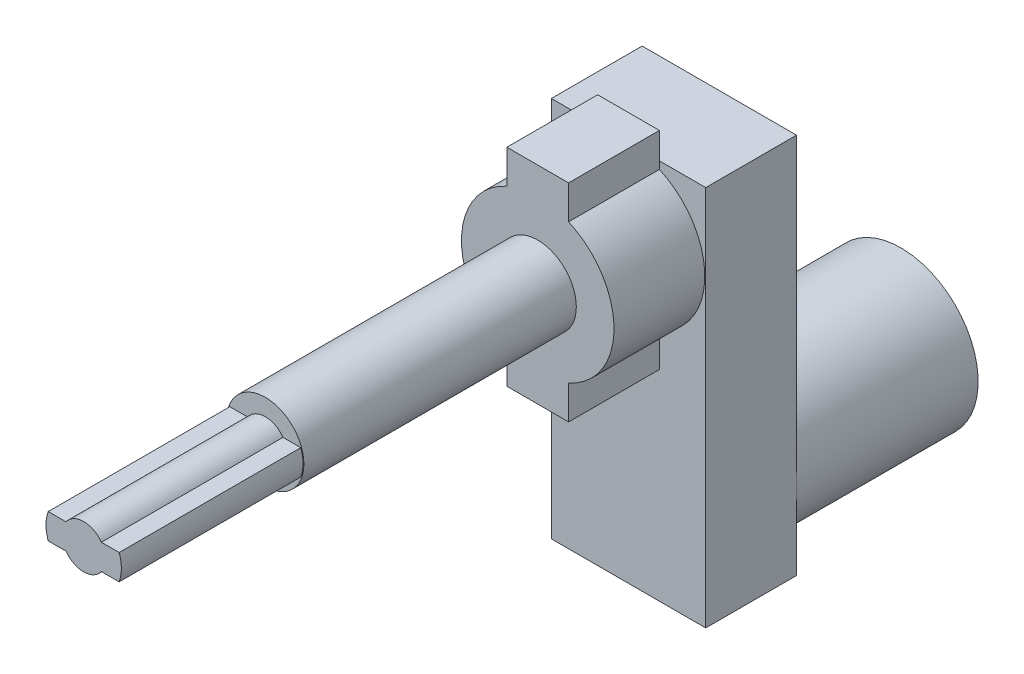
from build123d import *

# Parameters (mm, degrees)
BOSS_EXTRUDE2_START = -20
SKETCH3_R           = 4.25
BOSS_EXTRUDE2_DEPTH = 30
BOSS_EXTRUDE3_START = 10
SKETCH4_R           = 8.5
BOSS_EXTRUDE3_DEPTH = 10
SKETCH5_W           = 17
SKETCH5_H           = 42
BOSS_EXTRUDE4_DEPTH = 10
SKETCH6_R           = 8.5
BOSS_EXTRUDE5_DEPTH = 20
SKETCH9_W           = 7
SKETCH9_H           = 7
CUT_EXTRUDE1_DEPTH  = 20
BOSS_EXTRUDE7_DEPTH = 10
BOSS_EXTRUDE8_DEPTH = 20


with BuildPart() as part:
    # Sketch3 → Boss-Extrude2 (new body)
    with BuildSketch(Plane.XY.offset(16).offset(BOSS_EXTRUDE2_START)):
        Circle(SKETCH3_R)
    extrude(amount=BOSS_EXTRUDE2_DEPTH)



with BuildPart() as body_2:
    # Sketch4 → Boss-Extrude3 (new body)
    with BuildSketch(Plane(origin=(0, 0, -4), x_dir=(-1, 0, 0), z_dir=(0, 0, -1)).offset(BOSS_EXTRUDE3_START)):
        Circle(SKETCH4_R)
    extrude(amount=BOSS_EXTRUDE3_DEPTH)

    # Sketch5 → Boss-Extrude4 (add)
    with BuildSketch(Plane(origin=(0, 0, -24), x_dir=(-1, 0, 0), z_dir=(0, 0, -1))):
        with Locations((0, -12.5)):
            Rectangle(SKETCH5_W, SKETCH5_H)
    extrude(amount=-BOSS_EXTRUDE4_DEPTH)

    # Sketch6 → Boss-Extrude5 (add)
    with BuildSketch(Plane(origin=(0, 0, -24), x_dir=(-1, 0, 0), z_dir=(0, 0, -1))):
        with Locations((0, -25)):
            Circle(SKETCH6_R)
    extrude(amount=BOSS_EXTRUDE5_DEPTH)

    # Sketch9 → Cut-Extrude1 (cut)
    with BuildSketch(Plane(origin=(0, 0, -44), x_dir=(-1, 0, 0), z_dir=(0, 0, -1))):
        with Locations((0, -25)):
            Rectangle(SKETCH9_W, SKETCH9_H)
    extrude(amount=-CUT_EXTRUDE1_DEPTH, mode=Mode.SUBTRACT)


with BuildPart() as part_1:
    add(part.part)

    add(body_2.part)  # Boss-Extrude7 merges body 2
    # Sketch11 → Boss-Extrude7 (add)
    with BuildSketch(Plane.XY.offset(-14)):
        with BuildLine():
            Line((3.4, -7.681145748), (3.4, -11.4))
            Line((3.4, -11.4), (-3.4, -11.4))
            Line((-3.4, -11.4), (-3.4, -7.681145748))
            ThreePointArc((-3.4, -7.681145748), (-8.4, 0), (-3.4, 7.681145748))
            Line((-3.4, 7.681145748), (-3.4, 11.4))
            Line((-3.4, 11.4), (3.4, 11.4))
            Line((3.4, 11.4), (3.4, 7.681145748))
            ThreePointArc((3.4, 7.681145748), (8.4, 0), (3.4, -7.681145748))
        make_face()
    extrude(amount=BOSS_EXTRUDE7_DEPTH)

    # Sketch13 → Boss-Extrude8 (add)
    with BuildSketch(Plane.XY.offset(26)):
        with BuildLine():
            Line((-1.949358869, 1.4), (-3.906724971, 1.4))
            ThreePointArc((-3.906724971, 1.4), (-4.15, 0), (-3.906724971, -1.4))
            Line((-3.906724971, -1.4), (-1.949358869, -1.4))
            ThreePointArc((-1.949358869, -1.4), (0, -2.4), (1.949358869, -1.4))
            Line((1.949358869, -1.4), (3.906724971, -1.4))
            ThreePointArc((3.906724971, -1.4), (4.15, 0), (3.906724971, 1.4))
            Line((3.906724971, 1.4), (1.949358869, 1.4))
            ThreePointArc((1.949358869, 1.4), (0, 2.4), (-1.949358869, 1.4))
        make_face()
    extrude(amount=BOSS_EXTRUDE8_DEPTH)


solid = part_1.part
